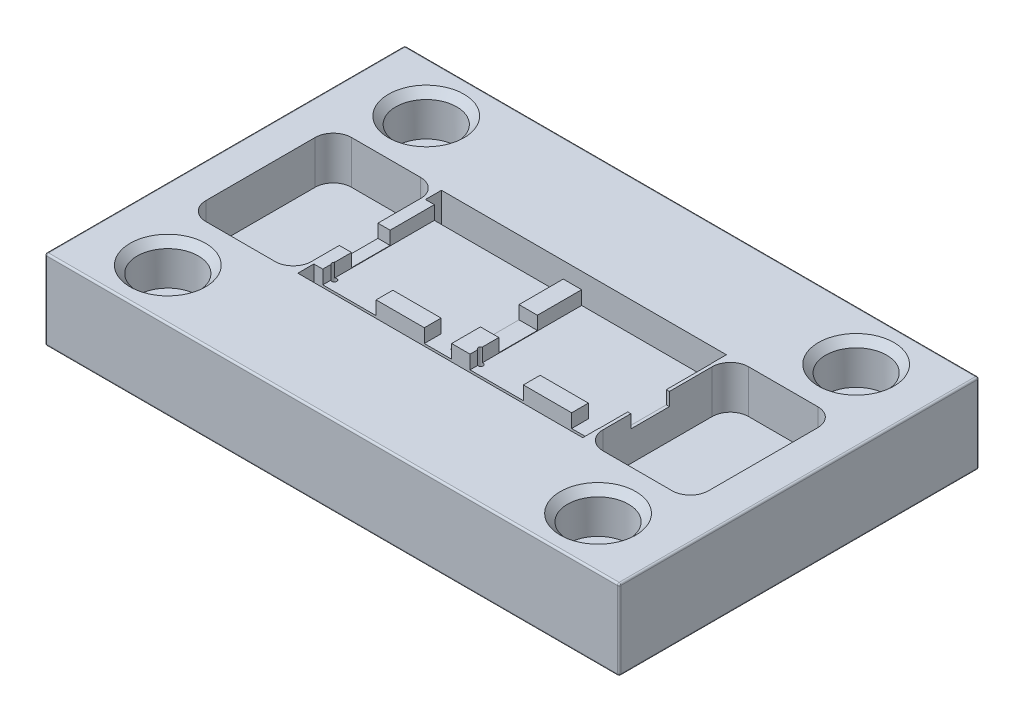
from build123d import *

# Parameters (mm, degrees)
SKETCH1_W             = 80.1116
SKETCH1_H             = 50.2158
BOSS_EXTRUDE1_DEPTH   = 11.176
HOLE1_D               = 4.191
HOLE1_CBORE_D         = 8.509
HOLE1_CBORE_DEPTH     = 5.7912
CHAMFER1_SIZE         = 1.016
FILLET1_R             = 0.254
CHAMFER2_SIZE         = 0.762
SKETCH4_W             = 39.751
SKETCH4_H             = 2.2352
CUT_EXTRUDE1_DEPTH    = 96.207132087
SKETCH5_R             = 1.2446
CUT_EXTRUDE2_DEPTH    = 4.2164
LPATTERN1_COUNT       = 2
LPATTERN1_PITCH       = 20.4216
F_1_0MM_DOWEL_HOLE1_D = 0.6858
SKETCH12_W            = 14.732
SKETCH12_H            = 20.32
CUT_EXTRUDE3_DEPTH    = 6.0198
FILLET2_R             = 2.54
CUT_EXTRUDE4_DEPTH    = 1.905
CUT_EXTRUDE5_REACH    = 81.263
SKETCH14_W            = 5.3848
SKETCH14_H            = 1.838231329


with BuildPart() as part:
    # Sketch1 → Boss-Extrude1 (new body)
    with BuildSketch(Plane(origin=(0, 0, 0), x_dir=(1, 0, 0), z_dir=(0, 1, 0))):
        with Locations((40.0558, 25.1079)):
            Rectangle(SKETCH1_W, SKETCH1_H)
    extrude(amount=BOSS_EXTRUDE1_DEPTH)

    # Hole1 (through all)
    with Locations(Plane(origin=(0, 11.176, 0), x_dir=(1, 0, 0), z_dir=(0, 1, 0))):
        with Locations((10.0457, 7.0993), (10.0584, 43.1419), (70.0532, 43.1292), (70.0532, 7.112)):
            CounterBoreHole(HOLE1_D / 2, HOLE1_CBORE_D / 2, HOLE1_CBORE_DEPTH)

    # Chamfer1
    chamfer1_edges = [part.edges().sort_by_distance(p)[0] for p in [
        (65.7987, 11.176, -7.112),
        (65.7987, 11.176, -43.1292),
        (5.8039, 11.176, -43.1419),
        (5.7912, 11.176, -7.0993),
    ]]
    chamfer(chamfer1_edges, length=CHAMFER1_SIZE)

    # Fillet1
    fillet1_edges = [part.edges().sort_by_distance(p)[0] for p in [
        (80.1116, 11.176, -25.1079),
        (40.0558, 11.176, -50.2158),
        (0, 11.176, -25.1079),
        (40.0558, 0, -50.2158),
        (80.1116, 0, -25.1079),
        (40.0558, 0, 0),
        (0, 0, -25.1079),
        (40.0558, 11.176, 0),
        (0, 5.588, -50.2158),
        (80.1116, 5.588, -50.2158),
        (80.1116, 5.588, 0),
        (0, 5.588, 0),
    ]]
    fillet(fillet1_edges, radius=FILLET1_R)

    # Chamfer2
    chamfer2_edges = [part.edges().sort_by_distance(p)[0] for p in [
        (72.1487, 0, -7.112),
        (72.1487, 0, -43.1292),
        (12.1539, 0, -43.1419),
        (12.1412, 0, -7.0993),
    ]]
    chamfer(chamfer2_edges, length=CHAMFER2_SIZE)

    # Sketch4 → Cut-Extrude1 (cut, through all)
    with BuildSketch(Plane.XZ):
        with Locations((39.9669, -16.3068)):
            Rectangle(SKETCH4_W, SKETCH4_H)
        with Locations((39.9669, -34.1122)):
            Rectangle(SKETCH4_W, SKETCH4_H)
    extrude(amount=-CUT_EXTRUDE1_DEPTH, mode=Mode.SUBTRACT)

    # Sketch5 → Cut-Extrude2 (cut)
    with BuildSketch(Plane.XZ):
        with Locations(Location((21.5646, -18.8214, 0), (0, 0, 270))):
            Circle(SKETCH5_R)
        with Locations(Location((38.3146, -18.8214, 0), (0, 0, 270))):
            Circle(SKETCH5_R)
    cut_extrude2 = extrude(amount=-CUT_EXTRUDE2_DEPTH, mode=Mode.SUBTRACT)

    # LPattern1: Cut-Extrude2 ×2
    with Locations(*[(i * LPATTERN1_PITCH, 0, 0) for i in range(1, LPATTERN1_COUNT)]):
        add(cut_extrude2, mode=Mode.SUBTRACT)

    # Ø1.0mm Dowel Hole1 (through all)
    with Locations(Plane(origin=(0, 4.2164, 0), x_dir=(-1, 0, 0), z_dir=(0, -1, 0))):
        with Locations((-21.5646, 18.8214), (-38.3146, 18.8214), (-41.9862, 18.8214), (-58.7362, 18.8214)):
            Hole(F_1_0MM_DOWEL_HOLE1_D / 2)

    # Sketch12 → Cut-Extrude3 (cut)
    with BuildSketch(Plane(origin=(0, 11.176, 0), x_dir=(1, 0, 0), z_dir=(0, 1, 0))):
        with Locations((12.2682, 25.1714)):
            Rectangle(SKETCH12_W, SKETCH12_H)
        with Locations((67.6656, 25.1714)):
            Rectangle(SKETCH12_W, SKETCH12_H)
    extrude(amount=-CUT_EXTRUDE3_DEPTH, mode=Mode.SUBTRACT)

    # Fillet2
    fillet2_edges = [part.edges().sort_by_distance(p)[0] for p in [
        (4.9022, 8.1661, -15.0114),
        (4.9022, 8.1661, -35.3314),
        (19.6342, 8.1661, -35.3314),
        (19.6342, 8.1661, -15.0114),
        (60.2996, 8.1661, -15.0114),
        (60.2996, 8.1661, -35.3314),
        (75.0316, 8.1661, -35.3314),
        (75.0316, 8.1661, -15.0114),
    ]]
    fillet(fillet2_edges, radius=FILLET2_R)

    # Sketch13 → Cut-Extrude4 (cut)
    with BuildSketch(Plane(origin=(0, 11.176, 0), x_dir=(1, 0, 0), z_dir=(0, 1, 0))):
        Polygon((28.7782, 19.7612), (35.5092, 19.7612), (35.5092, 17.4244), (39.3192, 17.4244), (39.3192, 19.7612), (39.3192, 32.9946), (21.336, 32.9946), (21.336, 19.7612), (21.336, 17.4244), (28.7782, 17.4244), align=None)
        Polygon((49.3268, 19.7612), (56.0578, 19.7612), (56.0578, 17.4244), (59.8678, 17.4244), (59.8678, 19.7612), (59.8678, 32.9946), (41.8846, 32.9946), (41.8846, 19.7612), (41.8846, 17.4244), (49.3268, 17.4244), align=None)
    extrude(amount=-CUT_EXTRUDE4_DEPTH, mode=Mode.SUBTRACT)

    # Cut-Extrude5: up to this face of the body (flat: up to its plane)
    cut_extrude5_end = Plane(part.part.faces().sort_by_distance((19.6342, 8.1661, -25.1714))[0])
    # Sketch14 → Cut-Extrude5 (cut, up to the picked face)
    with BuildSketch(Plane(origin=(60.2996, 0, 0), x_dir=(0, 0, -1), z_dir=(1, 0, 0)), mode=Mode.PRIVATE) as cut_extrude5_sk1:
        with Locations((24.13, 10.256884336)):
            Rectangle(SKETCH14_W, SKETCH14_H)
    cut_extrude5_tool1 = split(extrude(cut_extrude5_sk1.sketch, amount=-CUT_EXTRUDE5_REACH, mode=Mode.PRIVATE), bisect_by=cut_extrude5_end, keep=Keep.BOTH, mode=Mode.PRIVATE)
    add(cut_extrude5_tool1.solids().sort_by(Axis((60.2996, 10.256884, -24.13), (-1, 0, 0)))[0], mode=Mode.SUBTRACT)


solid = part.part
